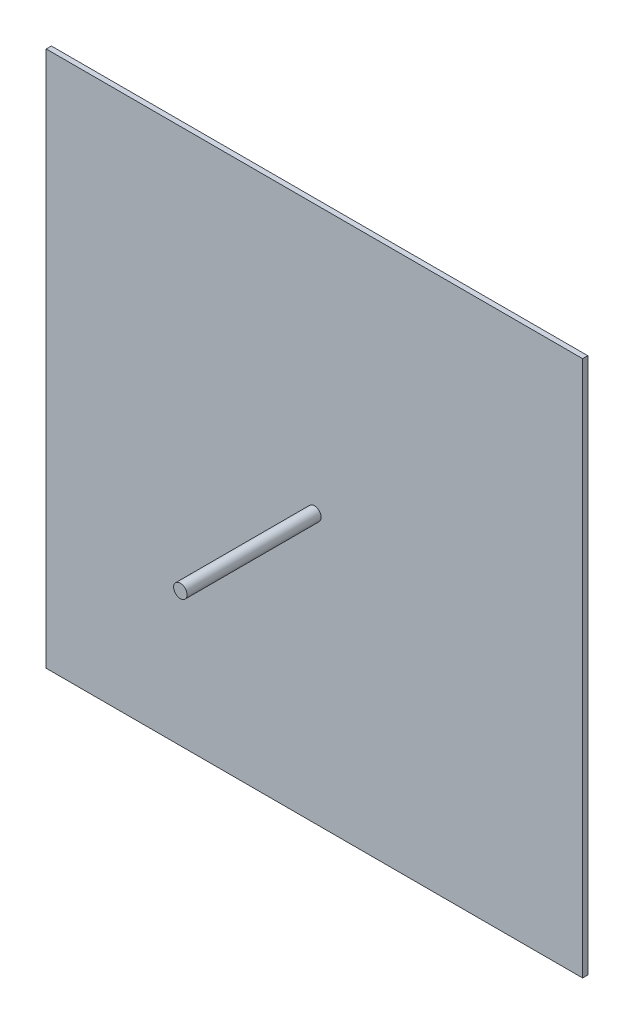
from build123d import *

# Parameters (mm, degrees)
SKETCH3_W           = 101.6
SKETCH3_H           = 101.6
BOSS_EXTRUDE2_DEPTH = 0.9779
SKETCH4_R           = 1.27
BOSS_EXTRUDE3_DEPTH = 25.4


with BuildPart() as part:
    # Sketch3 → Boss-Extrude2 (new body)
    with BuildSketch(Plane.XY):
        Rectangle(SKETCH3_W, SKETCH3_H)
    extrude(amount=BOSS_EXTRUDE2_DEPTH)

    # Sketch4 → Boss-Extrude3 (add)
    with BuildSketch(Plane.XY.offset(0.9779)):
        with Locations(Location((0, 0, 0), (0, 0, 180))):
            Circle(SKETCH4_R)
    extrude(amount=BOSS_EXTRUDE3_DEPTH)


solid = part.part
